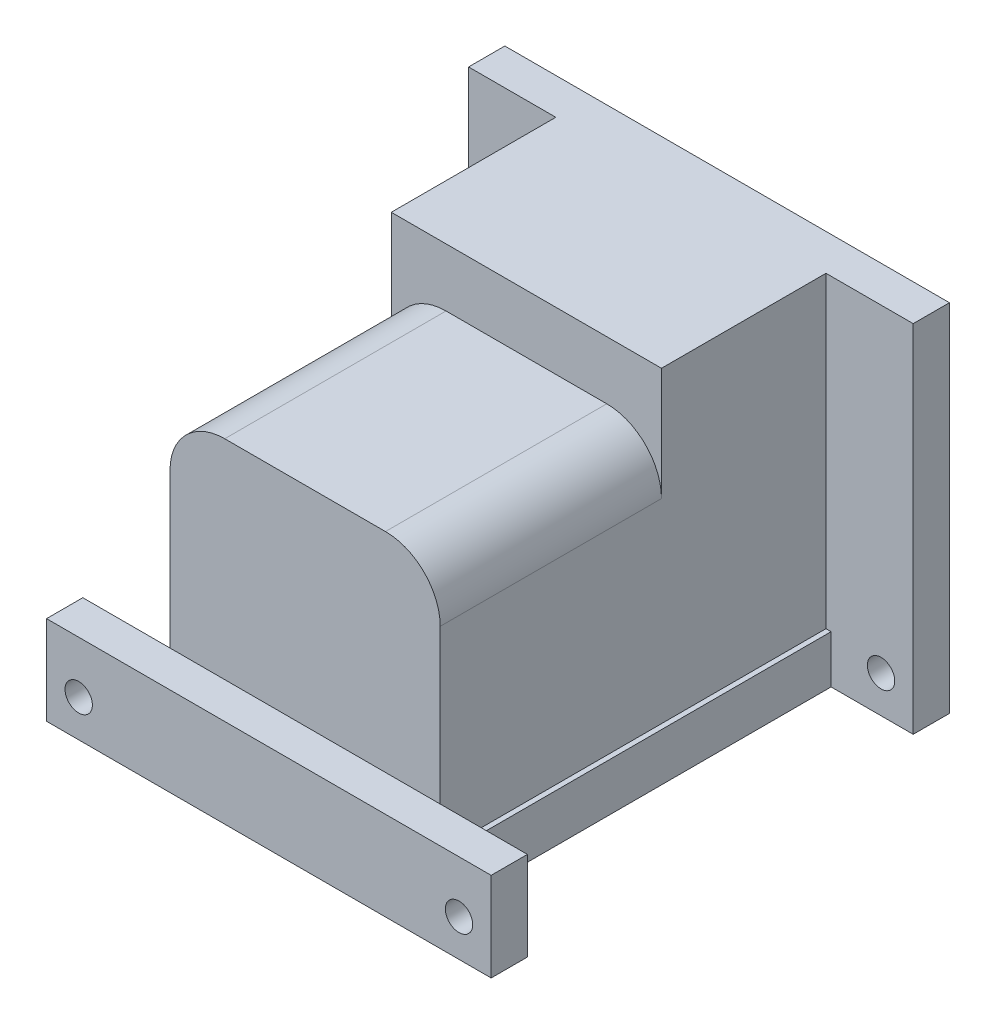
from build123d import *

# Parameters (mm, degrees)
RESSALTO_EXTRUS_O1_DEPTH = 52
ESBO_O2_R                = 2
CORTE_EXTRUS_O1_DEPTH    = 100
ESBO_O3_W                = 41
ESBO_O3_H                = 32.35
CORTE_EXTRUS_O2_DEPTH    = 8.5
ESBO_O8_W                = 65
ESBO_O8_H                = 5.3
CORTE_EXTRUS_O6_DEPTH    = 39
ESBO_O9_W                = 0.75
ESBO_O9_H                = 56.4
CORTE_EXTRUS_O7_DEPTH    = 45
FILETE6_R                = 8


with BuildPart() as part:
    # Esboço1 → Ressalto-extrusão1 (new body)
    with BuildSketch(Plane(origin=(0, 0, 0), x_dir=(1, 0, 0), z_dir=(0, 1, 0))):
        Polygon((-32.5, -28.2), (-20.5, -28.2), (-20.5, 28.2), (-32.5, 28.2), (-32.5, 33.5), (32.5, 33.5), (32.5, 28.2), (20.5, 28.2), (20.5, -28.2), (32.5, -28.2), (32.5, -33.5), (-32.5, -33.5), align=None)
    extrude(amount=RESSALTO_EXTRUS_O1_DEPTH)

    # Esboço2 → Corte-extrusão1 (cut)
    with BuildSketch(Plane.XY.offset(33.5)):
        with Locations((27.8, 5.4)):
            Circle(ESBO_O2_R)
        with Locations((-27.8, 5.4)):
            Circle(ESBO_O2_R)
    extrude(amount=-CORTE_EXTRUS_O1_DEPTH, mode=Mode.SUBTRACT)

    # Esboço3 → Corte-extrusão2 (cut)
    with BuildSketch(Plane(origin=(0, 52, 0), x_dir=(1, 0, 0), z_dir=(0, 1, 0))):
        with Locations((0, -12.025)):
            Rectangle(ESBO_O3_W, ESBO_O3_H)
    extrude(amount=-CORTE_EXTRUS_O2_DEPTH, mode=Mode.SUBTRACT)

    # Esboço8 → Corte-extrusão6 (cut)
    with BuildSketch(Plane(origin=(0, 52, 0), x_dir=(1, 0, 0), z_dir=(0, 1, 0))):
        with Locations((0, -30.85)):
            Rectangle(ESBO_O8_W, ESBO_O8_H)
    extrude(amount=-CORTE_EXTRUS_O6_DEPTH, mode=Mode.SUBTRACT)

    # Esboço9 → Corte-extrusão7 (cut)
    with BuildSketch(Plane(origin=(0, 52, 0), x_dir=(1, 0, 0), z_dir=(0, 1, 0))):
        with Locations((-20.125, 0)):
            Rectangle(ESBO_O9_W, ESBO_O9_H)
        with Locations((20.125, 0)):
            Rectangle(ESBO_O9_W, ESBO_O9_H)
    extrude(amount=-CORTE_EXTRUS_O7_DEPTH, mode=Mode.SUBTRACT)

    # Filete6
    filete6_edges = [part.edges().sort_by_distance(p)[0] for p in [
        (19.75, 43.5, 12.025),
        (-19.75, 43.5, 12.025),
    ]]
    fillet(filete6_edges, radius=FILETE6_R)


solid = part.part
